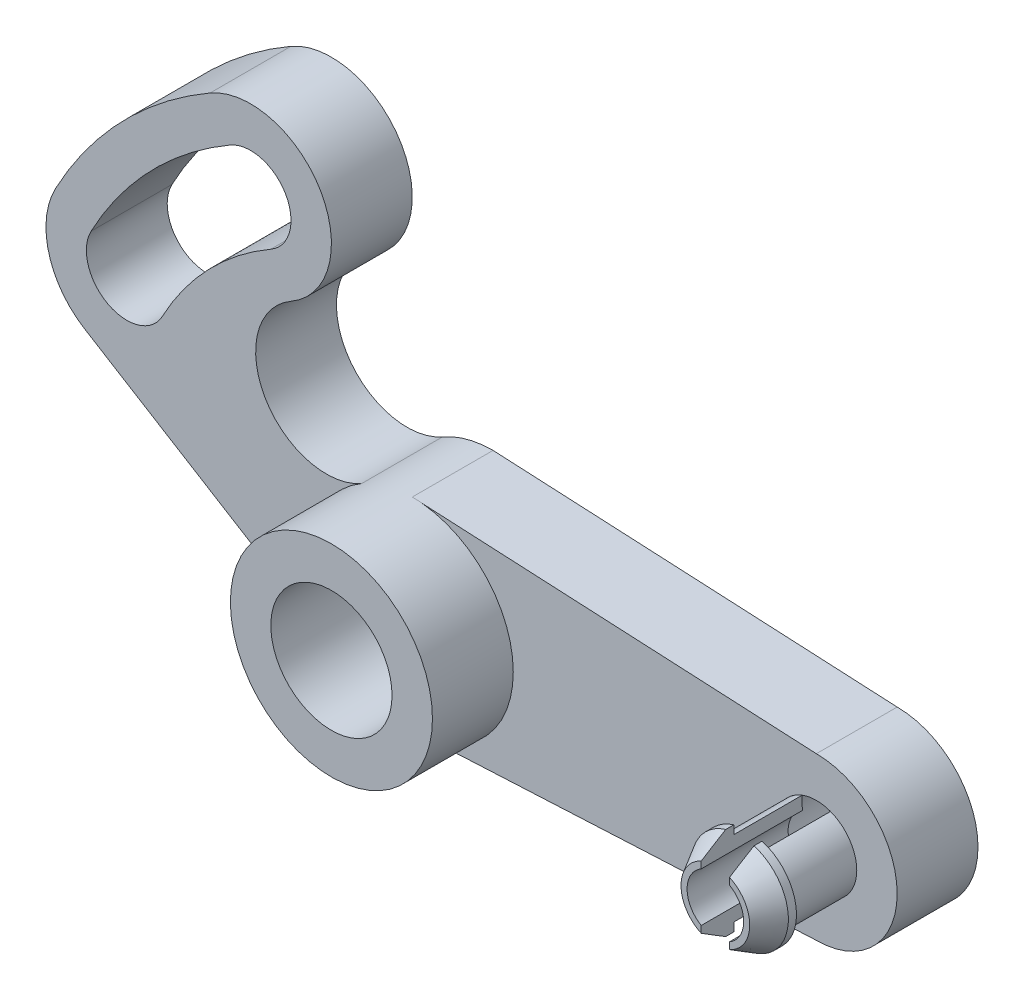
from build123d import *

# Parameters (mm, degrees)
ESQUISSE1_R             = 15
ESQUISSE1_R_2           = 10
BOSS_EXTRU_1_DEPTH      = 20
ESQUISSE2_R             = 25
ESQUISSE2_R_2           = 15
BOSS_EXTRU_2_DEPTH      = 20
CHANFREIN1_SIZE         = 2
ESQUISSE6_W             = 7
ESQUISSE6_H             = 24
ENL_V_MAT_EXTRU_2_DEPTH = 25


with BuildPart() as part:
    # Esquisse1 → Boss.-Extru.1 (new body)
    with BuildSketch(Plane.XY):
        with BuildLine():
            Line((0, -25), (100, -20))
            ThreePointArc((100, -20), (120, 0), (100, 20))
            Line((100, 20), (0, 25))
            ThreePointArc((0, 25), (-6.470476128, 24.148145657), (-12.5, 21.650635095))
            ThreePointArc((-12.5, 21.650635095), (-36.405444566, 28.056079661), (-30, 51.961524227))
            ThreePointArc((-30, 51.961524227), (-22.679491924, 79.282032303), (-50, 86.602540378))
            ThreePointArc((-50, 86.602540378), (-71.933980034, 69.465837046), (-88.294759286, 46.947156279))
            ThreePointArc((-88.294759286, 46.947156279), (-89.935062951, 32.30998872), (-81.108547088, 20.518895133))
            Line((-81.108547088, 20.518895133), (-12.5, -21.650635095))
            ThreePointArc((-12.5, -21.650635095), (-6.470476128, -24.148145657), (0, -25))
        make_face()
        Circle(ESQUISSE1_R, mode=Mode.SUBTRACT)
        with Locations((100, 0)):
            Circle(ESQUISSE1_R_2, mode=Mode.SUBTRACT)
        with BuildLine():
            ThreePointArc((-45, 77.942286341), (-64.74058203, 62.519253341), (-79.465283357, 42.252440651))
            ThreePointArc((-79.465283357, 42.252440651), (-75.330523057, 28.728249094), (-61.8063315, 32.863009395))
            ThreePointArc((-61.8063315, 32.863009395), (-50.353786024, 48.626085932), (-35, 60.621778265))
            ThreePointArc((-35, 60.621778265), (-31.339745962, 74.282032303), (-45, 77.942286341))
        make_face(mode=Mode.SUBTRACT)
    extrude(amount=BOSS_EXTRU_1_DEPTH)

    # Esquisse2 → Boss.-Extru.2 (add)
    with BuildSketch(Plane.XY.offset(20)):
        with Locations(Location((0, 0, 0), (0, 0, 236.846938275))):
            Circle(ESQUISSE2_R)
        Circle(ESQUISSE2_R_2, mode=Mode.SUBTRACT)
    extrude(amount=BOSS_EXTRU_2_DEPTH)

    # Chanfrein1
    chanfrein1_edges = [part.edges().sort_by_distance(p)[0] for p in [
        (-15, 0, 0),
    ]]
    chamfer(chanfrein1_edges, length=CHANFREIN1_SIZE)


with BuildPart() as body_2:
    # Esquisse5 → Révolution3 (revolve)
    with BuildSketch(Plane(origin=(100, 0, 0), x_dir=(0, 0, -1), z_dir=(1, 0, 0)), mode=Mode.PRIVATE) as r_volution3_sk:
        Polygon((-19.987919434, 7), (-44.987919434, 7), (-44.987919434, 8.5), (-38.925741608, 12), (-36.925741608, 12), (-36.925741608, 10), (-20, 10), align=None)
    revolve(r_volution3_sk.sketch.rotate(Axis((100, 0, 0), (0, 0, 1)), 90), axis=Axis((100, 0, 0), (0, 0, 1)))

    # Esquisse6 → Enlèv. mat.-Extru.2 (cut)
    with BuildSketch(Plane.XY.offset(44.987919434)):
        with Locations((100, 0)):
            Rectangle(ESQUISSE6_W, ESQUISSE6_H)
    extrude(amount=-ENL_V_MAT_EXTRU_2_DEPTH, mode=Mode.SUBTRACT)


with BuildPart() as enl_v_mat_extru_2_piece_1:
    # of the separate pieces the step leaves, piece 1, a body of its own (enl_v_mat_extru_2_pieces)
    add(body_2.part.solids().sort_by_distance((96.5, 6.062177826, 44.987919434))[0])


with BuildPart() as enl_v_mat_extru_2_piece_2:
    # of the separate pieces the step leaves, piece 2, a body of its own (enl_v_mat_extru_2_pieces)
    add(body_2.part.solids().sort_by_distance((103.5, -6.062177826, 19.987919434))[0])


solid = Compound([part.part, enl_v_mat_extru_2_piece_1.part, enl_v_mat_extru_2_piece_2.part])
